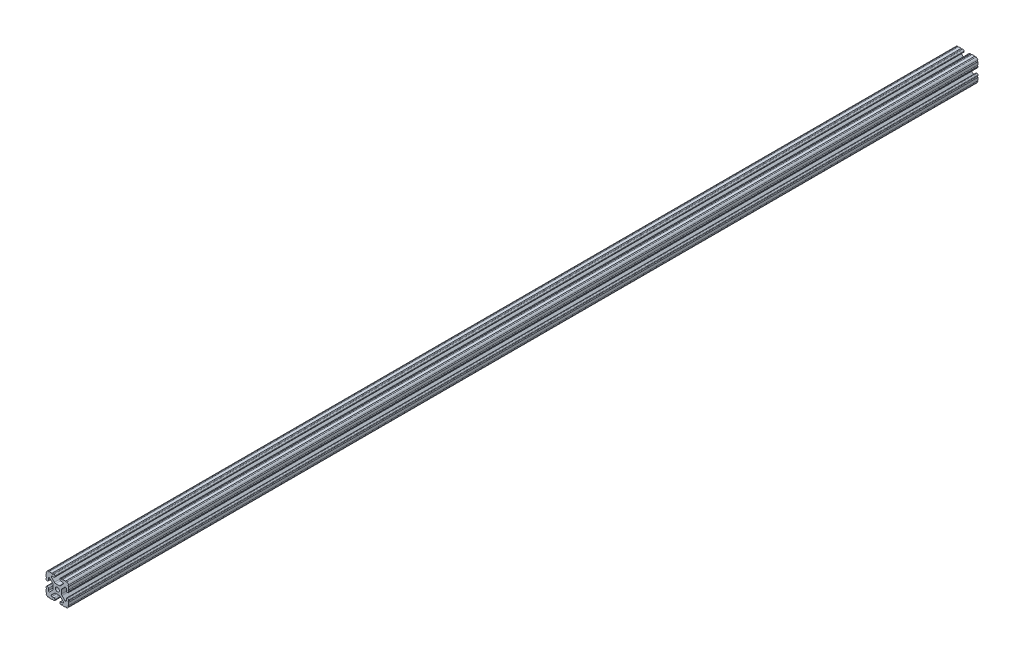
from build123d import *

# Parameters (mm, degrees)
BOSS_EXTRUDE1_DEPTH     = 762
CUT_EXTRUDE1_DEPTH      = 763.476101265
CUT_EXTRUDE1_DEPTH_BACK = 763.476101265
SKETCH5_R               = 1.016


with BuildPart() as part:
    # Sketch4 → Boss-Extrude1 (new, symmetric)
    with BuildSketch(Plane.XY):
        with BuildLine():
            Line((5.7912, -19.05), (14.3002, -19.05))
            ThreePointArc((14.3002, -19.05), (17.658815789, -17.658815789), (19.05, -14.3002))
            Line((19.05, -14.3002), (19.05, -5.7912))
            ThreePointArc((19.05, -5.7912), (18.544114832, -4.569885168), (17.3228, -4.064))
            Line((17.3228, -4.064), (16.7132, -4.064))
            ThreePointArc((16.7132, -4.064), (15.491885168, -4.569885168), (14.986, -5.7912))
            Line((14.986, -5.7912), (14.986, -8.996305235))
            ThreePointArc((14.986, -8.996305235), (14.189232738, -10.188751711), (12.782646215, -9.908964256))
            Line((12.782646215, -9.908964256), (7.888897763, -5.015215804))
            ThreePointArc((7.888897763, -5.015215804), (7.219915375, -4.014012907), (6.985, -2.833013566))
            Line((6.985, -2.833013566), (6.985, 0))
            Line((6.985, 0), (3.3274, 0))
            ThreePointArc((3.3274, 0), (2.352827104, -2.352827104), (0, -3.3274))
            Line((0, -3.3274), (0, -6.985))
            Line((0, -6.985), (2.833013566, -6.985))
            ThreePointArc((2.833013566, -6.985), (4.014012907, -7.219915375), (5.015215804, -7.888897763))
            Line((5.015215804, -7.888897763), (9.908964256, -12.782646215))
            ThreePointArc((9.908964256, -12.782646215), (10.188751711, -14.189232738), (8.996305235, -14.986))
            Line((8.996305235, -14.986), (5.7912, -14.986))
            ThreePointArc((5.7912, -14.986), (4.569885168, -15.491885168), (4.064, -16.7132))
            Line((4.064, -16.7132), (4.064, -17.3228))
            ThreePointArc((4.064, -17.3228), (4.569885168, -18.544114832), (5.7912, -19.05))
        make_face()
    extrude(amount=BOSS_EXTRUDE1_DEPTH, both=True)

    # Sketch5 → Cut-Extrude1 (cut, two sides: drawn at the far end of the back side and taken through both)
    with BuildSketch(Plane.XY.offset(-CUT_EXTRUDE1_DEPTH_BACK)):
        with Locations((14.739477062, -19.05)):
            Circle(SKETCH5_R)
        with Locations((7.980305235, -19.05)):
            Circle(SKETCH5_R)
        with Locations((19.05, -14.739477062)):
            Circle(SKETCH5_R)
        with Locations((19.05, -7.980305235)):
            Circle(SKETCH5_R)
    extrude(amount=CUT_EXTRUDE1_DEPTH + CUT_EXTRUDE1_DEPTH_BACK, mode=Mode.SUBTRACT)

    # Mirror1: part across plane


with BuildPart() as part_1:
    add(part.part)
    add(part.part.mirror(Plane(origin=(0, 0, 0), x_dir=(0, 0, 1), z_dir=(1, 0, 0))))

    # Mirror2: part across plane


with BuildPart() as part_2:
    add(part_1.part)
    add(part_1.part.mirror(Plane.ZX))


solid = part_2.part
